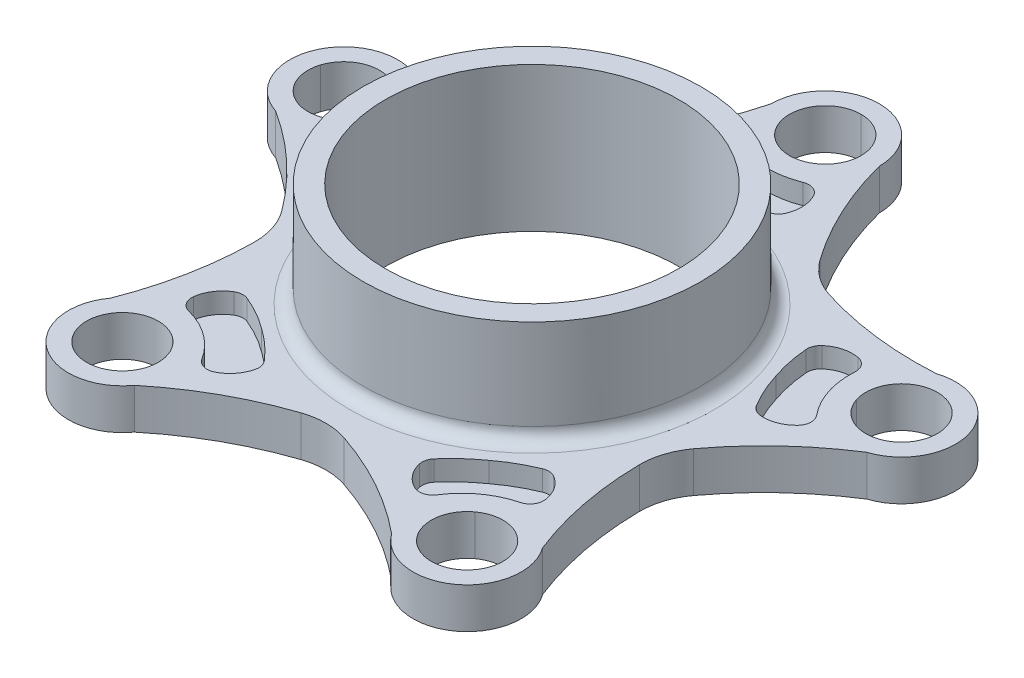
from build123d import *

# Parameters (mm, degrees)
SKETCH1_R                 = 31.75
CENTERCIRCLEEXTRUDE_DEPTH = 19.558
SKETCH2_R                 = 80.01
BASEEXPAND_DEPTH          = 7.62
SKETCH3_R                 = 27.559
CENTERCUT_DEPTH           = 27.178
SKETCH4_R                 = 6.731
OUTERCIRCLECUT_DEPTH      = 7.62
SKETCH8_R                 = 80.01
STARFISHCUT_DEPTH         = 7.62
FILLET8_R                 = 2.54
FILLET10_R                = 12.7
BATMAN_CUT_DEPTH          = 3.81
FILLET11_R                = 2.54


with BuildPart() as part:
    # Sketch1 → CenterCircleExtrude (new body)
    with BuildSketch(Plane(origin=(0, 0, 0), x_dir=(1, 0, 0), z_dir=(0, 1, 0))):
        Circle(SKETCH1_R)
    extrude(amount=CENTERCIRCLEEXTRUDE_DEPTH)

    # Sketch2 → BaseExpand (add)
    with BuildSketch(Plane.XZ):
        Circle(SKETCH2_R)
    extrude(amount=BASEEXPAND_DEPTH)

    # Sketch3 → CenterCut (cut)
    with BuildSketch(Plane(origin=(0, 19.558, 0), x_dir=(1, 0, 0), z_dir=(0, 1, 0))):
        Circle(SKETCH3_R)
    extrude(amount=-CENTERCUT_DEPTH, mode=Mode.SUBTRACT)

    # Sketch4 → OuterCircleCut (cut)
    with BuildSketch(Plane(origin=(0, 0, 0), x_dir=(1, 0, 0), z_dir=(0, 1, 0))):
        with Locations((0, 55.118)):
            Circle(SKETCH4_R)
        with Locations((52.420333065, 17.032398696)):
            Circle(SKETCH4_R)
        with Locations((32.397547536, -44.591398696)):
            Circle(SKETCH4_R)
        with Locations((-32.397547536, -44.591398696)):
            Circle(SKETCH4_R)
        with Locations((-52.420333065, 17.032398696)):
            Circle(SKETCH4_R)
    extrude(amount=-OUTERCIRCLECUT_DEPTH, mode=Mode.SUBTRACT)

    # Sketch8 → StarfishCut (cut)
    with BuildSketch(Plane(origin=(0, 0, 0), x_dir=(1, 0, 0), z_dir=(0, 1, 0))):
        Circle(SKETCH8_R)
        with BuildLine():
            ThreePointArc((-55.559945728, 7.36966449), (-62.083067271, 20.172011359), (-49.280720402, 26.695132902))
            ThreePointArc((-49.280720402, 26.695132902), (-35.631970511, 27.335423115), (-22.436174146, 30.88074446))
            ThreePointArc((-22.436174146, 30.88074446), (-14.986647849, 42.335128034), (-10.16, 55.118))
            ThreePointArc((-10.16, 55.118), (0, 65.278), (10.16, 55.118))
            ThreePointArc((10.16, 55.118), (14.986647849, 42.335128034), (22.436174146, 30.88074446))
            ThreePointArc((22.436174146, 30.88074446), (35.631970511, 27.335423115), (49.280720402, 26.695132902))
            ThreePointArc((49.280720402, 26.695132902), (58.392231228, 25.252011359), (62.580333065, 17.032398696))
            ThreePointArc((62.580333065, 17.032398696), (60.639945728, 11.060500533), (55.559945728, 7.36966449))
            ThreePointArc((55.559945728, 7.36966449), (44.894228259, -1.170875072), (36.302492346, -11.795394786))
            ThreePointArc((36.302492346, -11.795394786), (37.008416711, -25.440907452), (40.617160199, -38.619500533))
            ThreePointArc((40.617160199, -38.619500533), (42.060281741, -41.451786033), (42.557547536, -44.591398696))
            ThreePointArc((42.557547536, -44.591398696), (35.537160199, -54.254132902), (24.177934873, -50.563296859))
            ThreePointArc((24.177934873, -50.563296859), (12.759511114, -43.058768626), (0, -38.170699348))
            ThreePointArc((0, -38.170699348), (-12.759511114, -43.058768626), (-24.177934873, -50.563296859))
            ThreePointArc((-24.177934873, -50.563296859), (-38.369445699, -52.811011359), (-40.617160199, -38.619500533))
            ThreePointArc((-40.617160199, -38.619500533), (-37.008416711, -25.440907452), (-36.302492346, -11.795394786))
            ThreePointArc((-36.302492346, -11.795394786), (-44.894228259, -1.170875072), (-55.559945728, 7.36966449))
        make_face(mode=Mode.SUBTRACT)
    extrude(amount=-STARFISHCUT_DEPTH, mode=Mode.SUBTRACT)

    # Fillet8
    fillet8_edges = [part.edges().sort_by_distance(p)[0] for p in [
        (-31.75, 0, 0),
    ]]
    fillet(fillet8_edges, radius=FILLET8_R)

    # Fillet10
    fillet10_edges = [part.edges().sort_by_distance(p)[0] for p in [
        (-22.436174146, -3.81, -30.88074446),
        (-36.302492346, -3.81, 11.795394786),
        (0, -3.81, 38.170699348),
        (36.302492346, -3.81, 11.795394786),
        (22.436174146, -3.81, -30.88074446),
    ]]
    fillet(fillet10_edges, radius=FILLET10_R)

    # Sketch14 → Batman Cut (cut)
    with BuildSketch(Plane(origin=(0, 0, 0), x_dir=(1, 0, 0), z_dir=(0, 1, 0))):
        with BuildLine():
            ThreePointArc((38.21208836, 3.61640796), (36.123298629, 7.295617591), (34.592844745, 11.239896606))
            ThreePointArc((34.592844745, 11.239896606), (33.51261891, 15.330463583), (33.039900139, 19.534766499))
            ThreePointArc((33.039900139, 19.534766499), (36.998616208, 21.99136873), (41.568556549, 21.08474162))
            ThreePointArc((41.568556549, 21.08474162), (42.072446101, 13.670166407), (46.022968853, 7.375470207))
            ThreePointArc((46.022968853, 7.375470207), (42.858711498, 3.955849931), (38.21208836, 3.61640796))
        make_face()
        with BuildLine():
            ThreePointArc((7.207390506, 46.049590062), (0, 44.237587757), (-7.207390506, 46.049590062))
            ThreePointArc((-7.207390506, 46.049590062), (-9.481833356, 41.983481706), (-8.368776337, 37.459387154))
            ThreePointArc((-8.368776337, 37.459387154), (-4.224168519, 36.609768371), (0, 36.373069478))
            ThreePointArc((0, 36.373069478), (4.224168519, 36.609768371), (8.368776337, 37.459387154))
            ThreePointArc((8.368776337, 37.459387154), (9.481833356, 41.983481706), (7.207390506, 46.049590062))
        make_face()
        with BuildLine():
            ThreePointArc((15.24759305, -35.224324117), (18.101257819, -32.100828731), (21.37955382, -29.426431345))
            ThreePointArc((21.37955382, -29.426431345), (24.936106057, -27.135020814), (28.788557608, -25.386237496))
            ThreePointArc((28.788557608, -25.386237496), (32.348235709, -28.392068372), (32.898171317, -33.018503097))
            ThreePointArc((32.898171317, -33.018503097), (26.00220168, -35.788960285), (21.236368508, -41.491298791))
            ThreePointArc((21.236368508, -41.491298791), (17.006307064, -39.538631994), (15.24759305, -35.224324117))
        make_face()
        with BuildLine():
            ThreePointArc((-28.788557608, -25.386237496), (-24.936106057, -27.135020814), (-21.37955382, -29.426431345))
            ThreePointArc((-21.37955382, -29.426431345), (-18.101257819, -32.100828731), (-15.24759305, -35.224324117))
            ThreePointArc((-15.24759305, -35.224324117), (-17.006307064, -39.538631994), (-21.236368508, -41.491298791))
            ThreePointArc((-21.236368508, -41.491298791), (-26.00220168, -35.788960285), (-32.898171317, -33.018503097))
            ThreePointArc((-32.898171317, -33.018503097), (-32.348235709, -28.392068372), (-28.788557608, -25.386237496))
        make_face()
        with BuildLine():
            ThreePointArc((-33.039900139, 19.534766499), (-33.51261891, 15.330463583), (-34.592844745, 11.239896606))
            ThreePointArc((-34.592844745, 11.239896606), (-36.123298629, 7.295617591), (-38.21208836, 3.61640796))
            ThreePointArc((-38.21208836, 3.61640796), (-42.858711498, 3.955849931), (-46.022968853, 7.375470207))
            ThreePointArc((-46.022968853, 7.375470207), (-42.072446101, 13.670166407), (-41.568556549, 21.08474162))
            ThreePointArc((-41.568556549, 21.08474162), (-36.998616208, 21.99136873), (-33.039900139, 19.534766499))
        make_face()
    extrude(amount=-BATMAN_CUT_DEPTH, mode=Mode.SUBTRACT)

    # Fillet11
    fillet11_edges = [part.edges().sort_by_distance(p)[0] for p in [
        (21.236368508, -1.905, 41.491298791),
        (32.898171317, -1.905, 33.018503097),
        (28.788557608, -1.905, 25.386237496),
        (15.24759305, -1.905, 35.224324117),
        (-21.236368508, -1.905, 41.491298791),
        (-32.898171317, -1.905, 33.018503097),
        (-15.24759305, -1.905, 35.224324117),
        (-28.788557608, -1.905, 25.386237496),
        (-38.21208836, -1.905, -3.61640796),
        (-46.022968853, -1.905, -7.375470207),
        (-33.039900139, -1.905, -19.534766499),
        (-41.568556549, -1.905, -21.08474162),
        (38.21208836, -1.905, -3.61640796),
        (33.039900139, -1.905, -19.534766499),
        (46.022968853, -1.905, -7.375470207),
        (41.568556549, -1.905, -21.08474162),
        (-8.368776337, -1.905, -37.459387154),
        (8.368776337, -1.905, -37.459387154),
        (-7.207390506, -1.905, -46.049590062),
        (7.207390506, -1.905, -46.049590062),
    ]]
    fillet(fillet11_edges, radius=FILLET11_R)


solid = part.part
